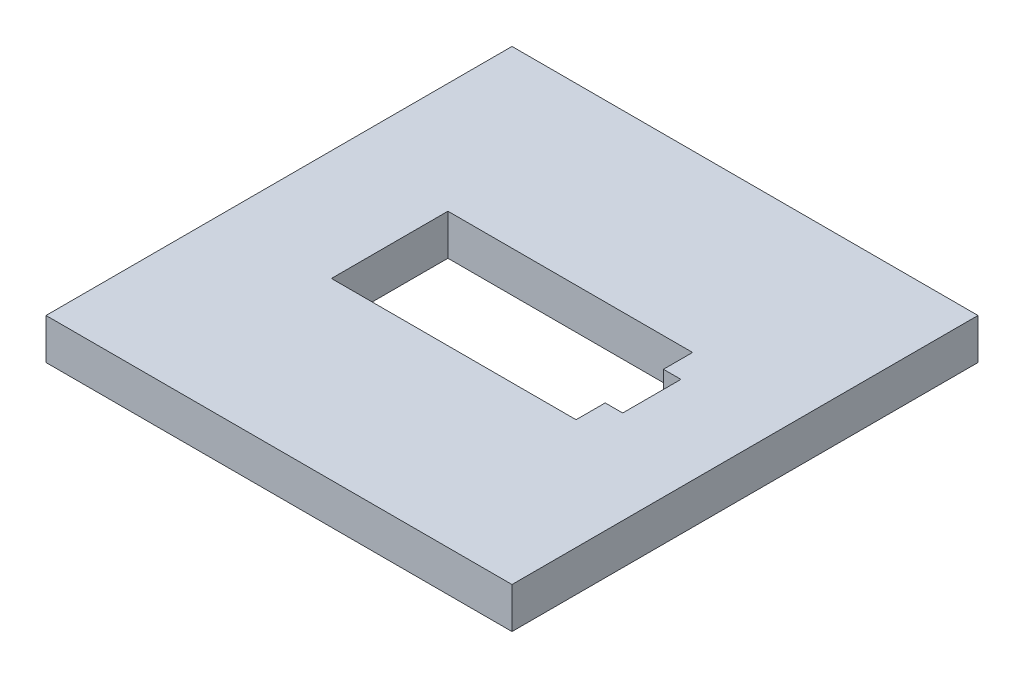
from build123d import *

# Parameters (mm, degrees)
CROQUIS1_W              = 80
CROQUIS1_H              = 80
SALIENTE_EXTRUIR1_DEPTH = 7
CORTAR_EXTRUIR1_DEPTH   = 58


with BuildPart() as part:
    # Croquis1 → Saliente-Extruir1 (new body)
    with BuildSketch(Plane(origin=(0, 0, 0), x_dir=(1, 0, 0), z_dir=(0, 1, 0))):
        Rectangle(CROQUIS1_W, CROQUIS1_H)
    extrude(amount=SALIENTE_EXTRUIR1_DEPTH)

    # Croquis2 → Cortar-Extruir1 (cut, through all)
    with BuildSketch(Plane(origin=(0, 7, 0), x_dir=(1, 0, 0), z_dir=(0, 1, 0))):
        Polygon((21, 5), (24, 5), (24, -5), (21, -5), (21, -10), (-21, -10), (-21, 10), (21, 10), align=None)
    extrude(amount=-CORTAR_EXTRUIR1_DEPTH, mode=Mode.SUBTRACT)


solid = part.part
